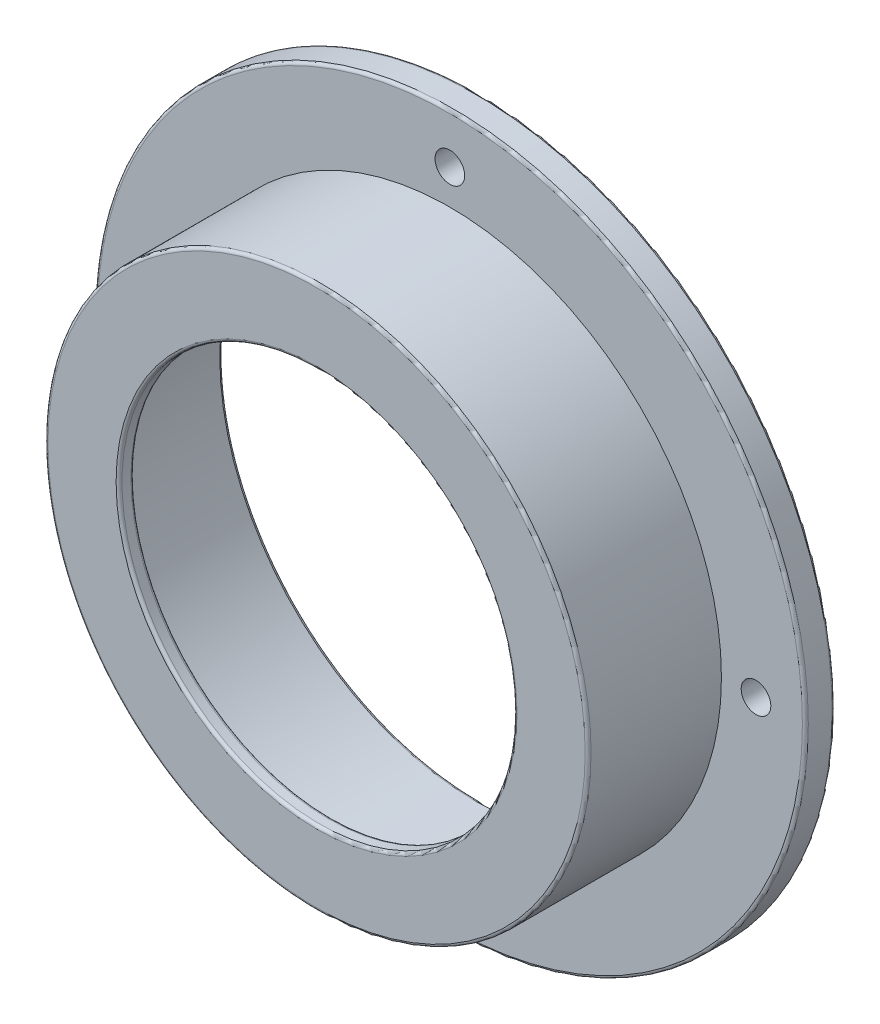
from build123d import *

# Parameters (mm, degrees)
SKETCH_1_R               = 36
EXTRUDE_1_DEPTH          = 3
SKETCH_2_R               = 27.5
EXTRUDE_2_DEPTH          = 12.5
SKETCH_3_R               = 26
CUT_EXTRUDE_1_DEPTH      = 15
SKETCH_4_R               = 27.5
EXTRUDE_3_DEPTH          = 1
SKETCH_6_R               = 1.5
CUT_EXTRUDE_3_DEPTH      = 3
PATTERN_CIRCULAR_1_COUNT = 4
SKETCH_7_R               = 20
CUT_EXTRUDE_4_DEPTH      = 10
FILLET_1_R               = 0.3


with BuildPart() as part:
    # 草图1 → 凸台-拉伸1 (new body)
    with BuildSketch(Plane.XY):
        Circle(SKETCH_1_R)
    extrude(amount=EXTRUDE_1_DEPTH)

    # 草图2 → 凸台-拉伸2 (add)
    with BuildSketch(Plane.XY.offset(3)):
        Circle(SKETCH_2_R)
    extrude(amount=EXTRUDE_2_DEPTH)

    # 草图3 → 切除-拉伸1 (cut)
    with BuildSketch(Plane(origin=(0, 0, 0), x_dir=(-1, 0, 0), z_dir=(0, 0, -1))):
        Circle(SKETCH_3_R)
    extrude(amount=-CUT_EXTRUDE_1_DEPTH, mode=Mode.SUBTRACT)

    # 草图4 → 凸台-拉伸3 (add)
    with BuildSketch(Plane.XY.offset(15.5)):
        Circle(SKETCH_4_R)
    extrude(amount=EXTRUDE_3_DEPTH)

    # 草图6 → 切除-拉伸3 (cut)
    with BuildSketch(Plane(origin=(0, 0, 0), x_dir=(-1, 0, 0), z_dir=(0, 0, -1))):
        with Locations((0, 31)):
            Circle(SKETCH_6_R)
    cut_extrude_3 = extrude(amount=-CUT_EXTRUDE_3_DEPTH, mode=Mode.SUBTRACT)

    # 阵列(圆周)1: 切除-拉伸3 ×4 about axis
    pattern_circular_1_axis = Axis((0, 0, 0), (0, 0, 1))
    for i in range(1, PATTERN_CIRCULAR_1_COUNT):
        add(cut_extrude_3.rotate(pattern_circular_1_axis, i * 360 / PATTERN_CIRCULAR_1_COUNT), mode=Mode.SUBTRACT)

    # 草图7 → 切除-拉伸4 (cut)
    with BuildSketch(Plane.XY.offset(16.5)):
        Circle(SKETCH_7_R)
    extrude(amount=-CUT_EXTRUDE_4_DEPTH, mode=Mode.SUBTRACT)

    # 圆角1
    fillet_1_edges = [part.edges().sort_by_distance(p)[0] for p in [
        (26, 0, 0),
        (-27.5, 0, 16.5),
        (-36, 0, 0),
        (-20, 0, 15),
        (-20, 0, 16.5),
        (-36, 0, 3),
    ]]
    fillet(fillet_1_edges, radius=FILLET_1_R)


solid = part.part
